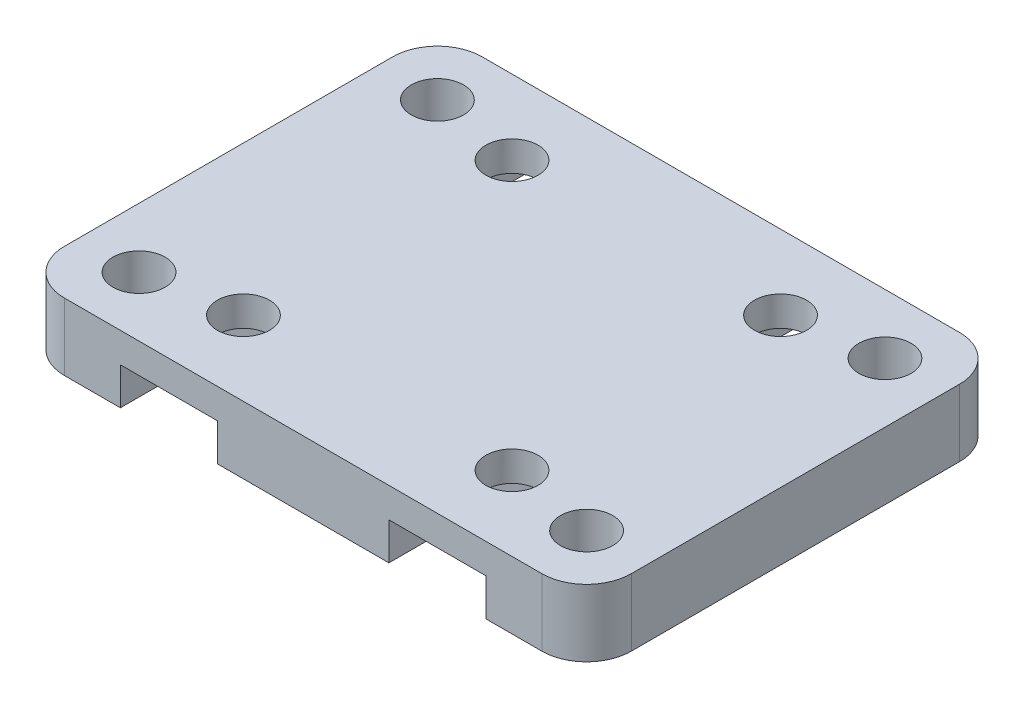
from build123d import *

# Parameters (mm, degrees)
SKETCH_1_W              = 38
SKETCH_1_H              = 28
EXTRUDE_1_DEPTH         = 2.25
HOLE_WIZARD_3_5_3_5_2_D = 3.5
HOLE_WIZARD_3_5_3_5_4_D = 3.5
CUT_EXTRUDE_2_DEPTH     = 2.5
MIRROR_4_COPY_1_DEPTH   = 2.5
FILLET_2_R              = 3


with BuildPart() as part:
    # 草圖1 → 填料-伸長1 (new, symmetric)
    with BuildSketch(Plane(origin=(0, 0, 0), x_dir=(1, 0, 0), z_dir=(0, 1, 0))):
        Rectangle(SKETCH_1_W, SKETCH_1_H)
    extrude(amount=EXTRUDE_1_DEPTH, both=True)

    # Ø3.5 (3.5) 直徑孔2 (through all)
    with Locations(Plane(origin=(0, 2.25, 0), x_dir=(1, 0, 0), z_dir=(0, 1, 0))):
        with Locations((15, 10), (-15, -10), (-15, 10), (15, -10)):
            Hole(HOLE_WIZARD_3_5_3_5_2_D / 2)

    # Ø3.5 (3.5) 直徑孔4 (through all)
    with Locations(Plane(origin=(0, 2.25, 0), x_dir=(1, 0, 0), z_dir=(0, 1, 0))):
        with Locations((9, 9), (-9, -9), (-9, 9), (9, -9)):
            Hole(HOLE_WIZARD_3_5_3_5_4_D / 2)

    # 草圖9 → 除料-伸長2 (cut)
    with BuildSketch(Plane.XZ.offset(2.25)):
        Polygon((-12.25, 10.876388375), (-12.25, 14), (-5.75, 14), (-5.75, 10.876388375), (-5.75, 7.123611625), (-9, 5.24722325), (-12.25, 7.123611625), align=None)
    cut_extrude_2 = extrude(amount=-CUT_EXTRUDE_2_DEPTH, mode=Mode.SUBTRACT)

    # 鏡射3: 除料-伸長2 across plane
    add(cut_extrude_2.mirror(Plane.XY), mode=Mode.SUBTRACT)

    # 鏡射4: 除料-伸長2 across plane
    add(cut_extrude_2.mirror(Plane(origin=(0, 0, 0), x_dir=(0, 0, 1), z_dir=(1, 0, 0))), mode=Mode.SUBTRACT)

    # 鏡射4 copy 1 sketch → 鏡射4 copy 1 (cut)
    with BuildSketch(Plane(origin=(0, -2.25, 0), x_dir=(-1, 0, 0), z_dir=(0, -1, 0))):
        Polygon((-12.25, 10.876388375), (-12.25, 14), (-5.75, 14), (-5.75, 10.876388375), (-5.75, 7.123611625), (-9, 5.24722325), (-12.25, 7.123611625), align=None)
    extrude(amount=-MIRROR_4_COPY_1_DEPTH, mode=Mode.SUBTRACT)

    # 圓角2
    fillet_2_edges = [part.edges().sort_by_distance(p)[0] for p in [
        (19, 0, 14),
        (-19, 0, 14),
        (-19, 0, -14),
        (19, 0, -14),
    ]]
    fillet(fillet_2_edges, radius=FILLET_2_R)


solid = part.part
